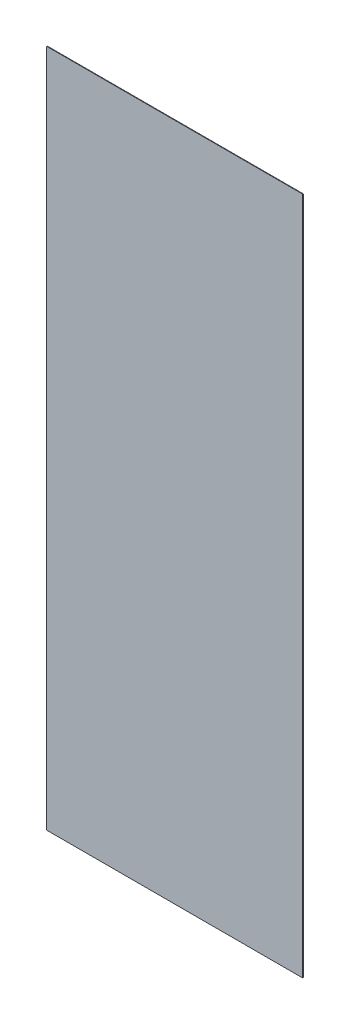
from build123d import *

# Parameters (mm, degrees)
PRESS_DIS_ARKA_1_START = -818.5
SKETCH1_W              = 697
SKETCH1_H              = 1848.5
PRESS_DIS_ARKA_1_DEPTH = 1.5


with BuildPart() as part:
    # Sketch1 → PRESS_dis_arka_1 (new body)
    with BuildSketch(Plane.XY.offset(PRESS_DIS_ARKA_1_START)):
        with Locations((350, 1044.25)):
            Rectangle(SKETCH1_W, SKETCH1_H)
    extrude(amount=-PRESS_DIS_ARKA_1_DEPTH)


solid = part.part
